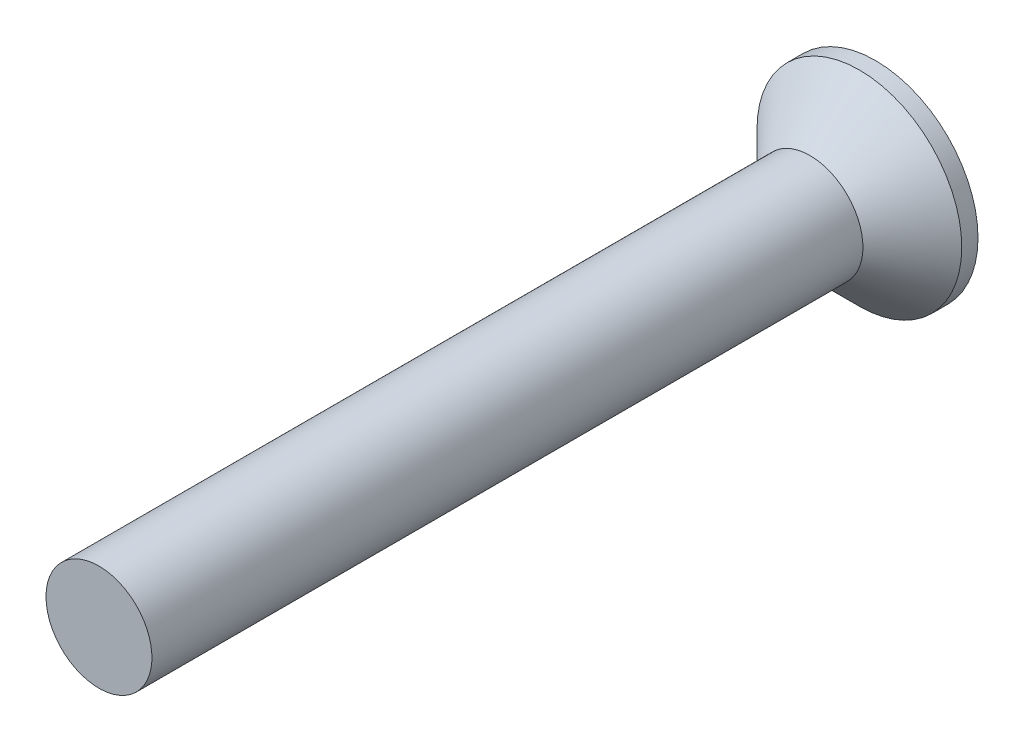
from build123d import *

# Parameters (mm, degrees)
CUT_EXTRUDE1_DEPTH = 2


with BuildPart() as part:
    # Sketch1 → Revolve1 (revolve)
    with BuildSketch(Plane(origin=(0, 0, 0), x_dir=(1, 0, 0), z_dir=(0, 1, 0)), mode=Mode.PRIVATE) as revolve1_sk:
        Polygon((0, 0), (1.5, 0), (1.5, 20.14), (2.9, 21.54), (2.9, 22), (0, 22), align=None)
    revolve(revolve1_sk.sketch.rotate(Axis((0, 0, -22), (0, 0, 1)), 180), axis=Axis((0, 0, -22), (0, 0, 1)))

    # Sketch2 → Cut-Extrude1 (cut)
    with BuildSketch(Plane(origin=(0, 0, -22), x_dir=(-1, 0, 0), z_dir=(0, 0, -1))):
        Polygon((-0.721687836, -1.25), (0.721687836, -1.25), (1.443375673, 0), (0.721687836, 1.25), (-0.721687836, 1.25), (-1.443375673, 0), align=None)
    extrude(amount=-CUT_EXTRUDE1_DEPTH, mode=Mode.SUBTRACT)


solid = part.part
